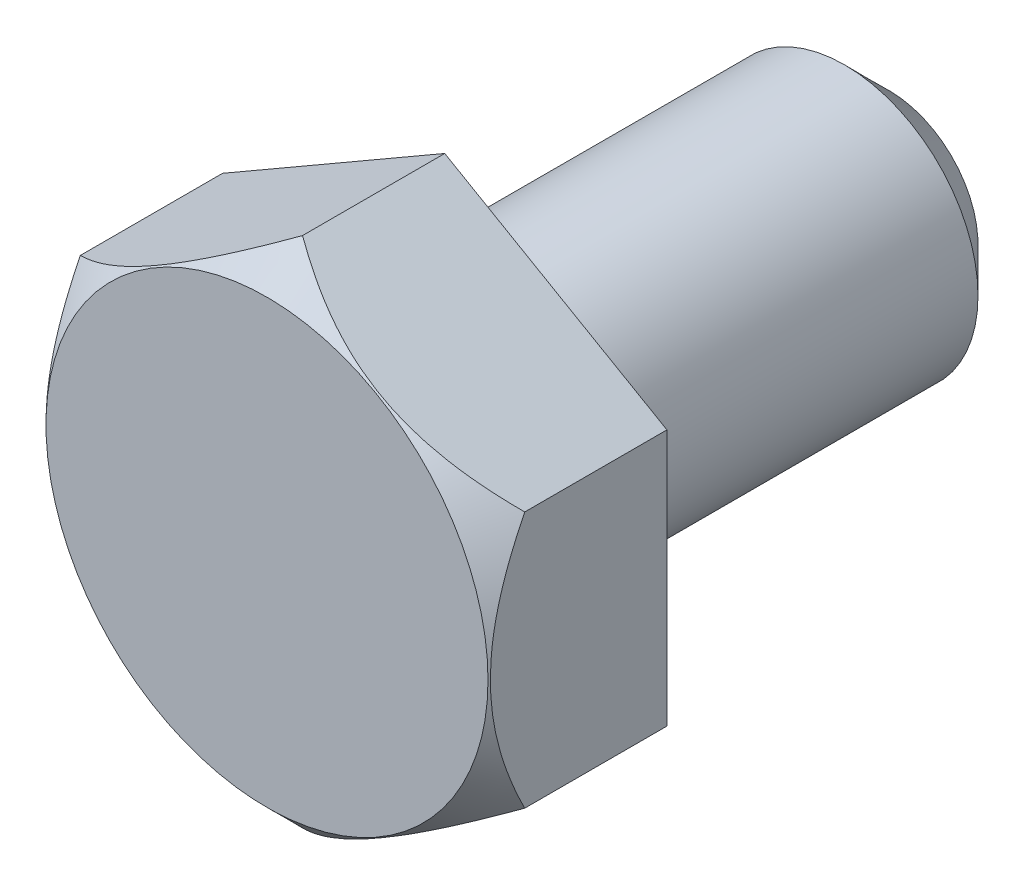
from build123d import *

# Parameters (mm, degrees)
EXTRUDE_1_DEPTH = 4
SKETCH_2_R      = 3
EXTRUDE_2_DEPTH = 10
CHAMFER_1_SIZE  = 1


with BuildPart() as part:
    # Эскиз1 → Вытянуть1 (new body)
    with BuildSketch(Plane.XY):
        Polygon((0, 5.773502692), (-5, 2.886751346), (-5, -2.886751346), (0, -5.773502692), (5, -2.886751346), (5, 2.886751346), align=None)
    extrude(amount=EXTRUDE_1_DEPTH)

    # Эскиз2 → Вытянуть2 (add)
    with BuildSketch(Plane(origin=(0, 0, 0), x_dir=(-1, 0, 0), z_dir=(0, 0, -1))):
        with Locations(Location((0, 0, 0), (0, 0, 180))):
            Circle(SKETCH_2_R)
    extrude(amount=EXTRUDE_2_DEPTH)

    # Эскиз15 → Вырез-Повернуть1 (revolve, cut)
    with BuildSketch(Plane(origin=(0, 0, 0), x_dir=(0, 0, -1), z_dir=(1, 0, 0)), mode=Mode.PRIVATE) as cut_revolve_1_sk:
        Polygon((-4, 5.773502692), (-4, 4.973502692), (-3.2, 5.773502692), align=None)
    revolve(cut_revolve_1_sk.sketch.rotate(Axis((0, 0, 2.465296569), (0, 0, -1)), 300.000000095), axis=Axis((0, 0, 2.465296569), (0, 0, -1)), mode=Mode.SUBTRACT)

    # Фаска1
    chamfer_1_edges = [part.edges().sort_by_distance(p)[0] for p in [
        (-3, 0, -10),
    ]]
    chamfer(chamfer_1_edges, length=CHAMFER_1_SIZE)


solid = part.part
